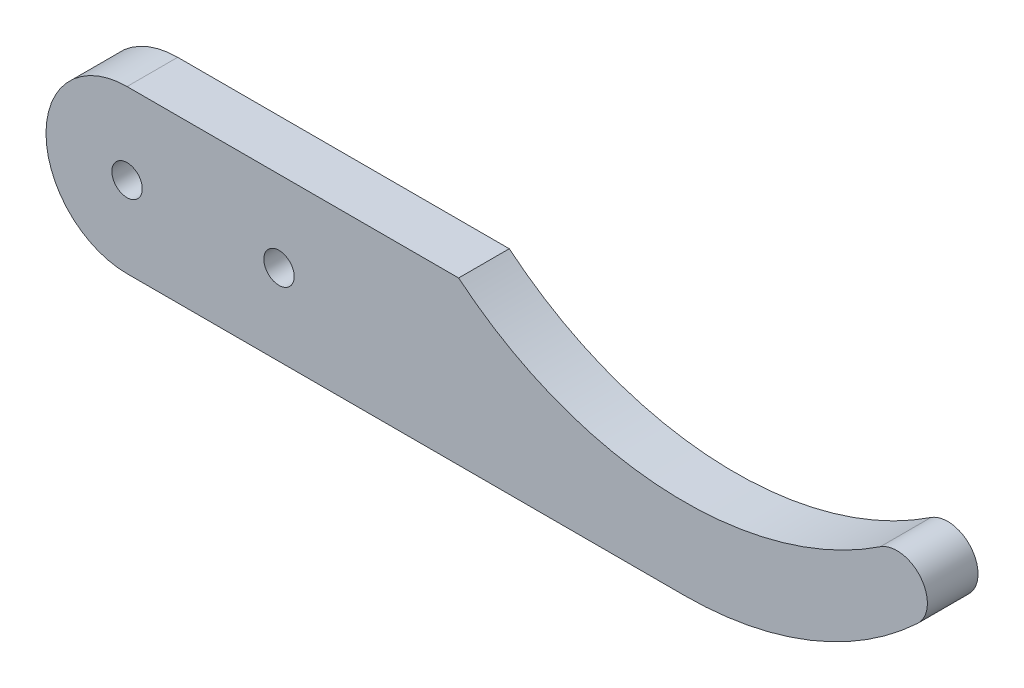
from build123d import *

# Parameters (mm, degrees)
ESQUISSE1_R        = 1.5
BOSS_EXTRU_1_DEPTH = 5


with BuildPart() as part:
    # Esquisse1 → Boss.-Extru.1 (new body)
    with BuildSketch(Plane.XY):
        with BuildLine():
            Line((0, 8), (17.728942549, 8))
            ThreePointArc((17.728942549, 8), (38.177418085, 0.047486569), (59.342105263, 5.830101749))
            ThreePointArc((59.342105263, 5.830101749), (63.350754016, 5.193679781), (63.05640037, 1.145513075))
            ThreePointArc((63.05640037, 1.145513075), (52.401995882, -5.630136101), (40, -8))
            Line((40, -8), (0, -8))
            Line((0, -8), (-15, -8))
            ThreePointArc((-15, -8), (-23, 0), (-15, 8))
            Line((-15, 8), (0, 8))
        make_face()
        Circle(ESQUISSE1_R, mode=Mode.SUBTRACT)
        with Locations((-15, 0)):
            Circle(ESQUISSE1_R, mode=Mode.SUBTRACT)
    extrude(amount=BOSS_EXTRU_1_DEPTH)


solid = part.part
